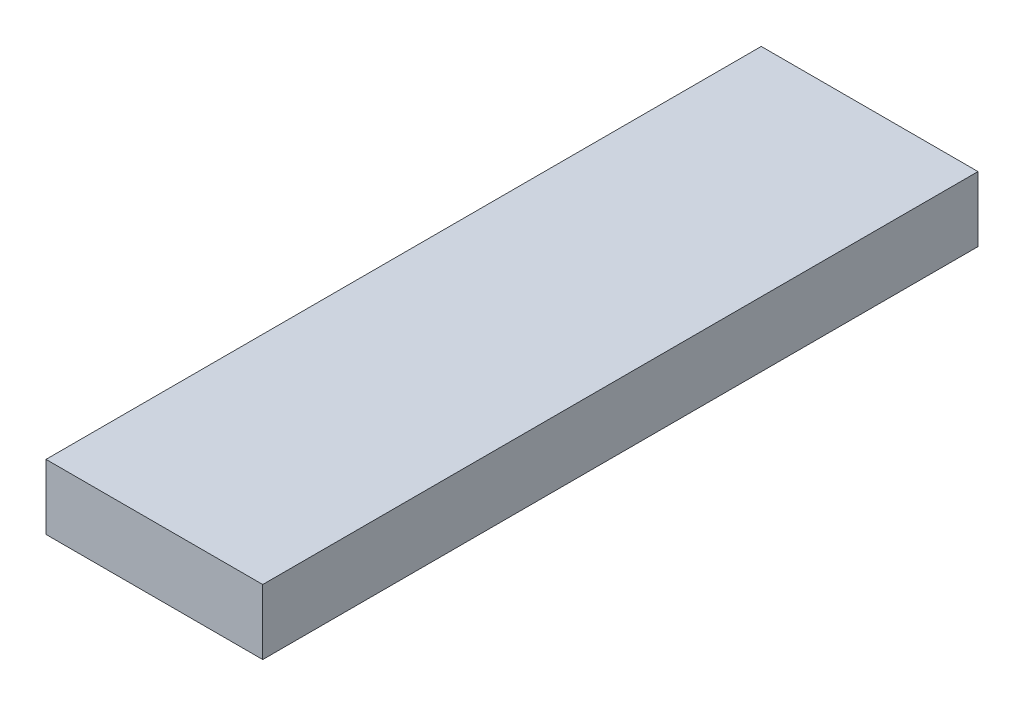
from build123d import *

# Parameters (mm, degrees)
SKETCH_1_W      = 10
SKETCH_1_H      = 33
EXTRUDE_1_DEPTH = 3


with BuildPart() as part:
    # 草图1 → 凸台-拉伸1 (new body)
    with BuildSketch(Plane(origin=(0, 0, 0), x_dir=(1, 0, 0), z_dir=(0, 1, 0))):
        Rectangle(SKETCH_1_W, SKETCH_1_H)
    extrude(amount=EXTRUDE_1_DEPTH)


solid = part.part
